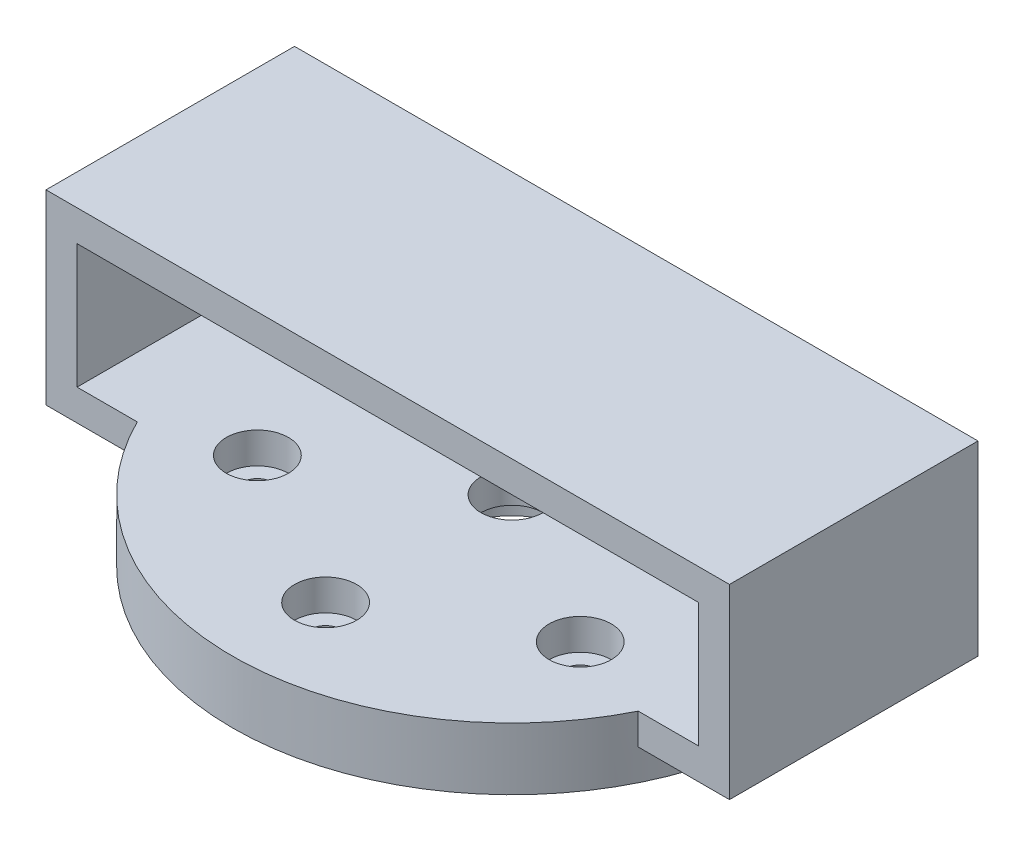
from build123d import *

# Parameters (mm, degrees)
SKETCH1_R                = 45
SKETCH1_R_2              = 2.5
SKETCH1_R_3              = 10
BOSS_EXTRUDE1_DEPTH      = 10
BOSS_EXTRUDE2_DEPTH      = 25
BOSS_EXTRUDE2_DEPTH_BACK = 5
SKETCH2_W                = 110
SKETCH2_H                = 40
SKETCH3_W                = 100
SKETCH3_H                = 20
CUT_EXTRUDE1_DEPTH       = 45
SKETCH4_R                = 5
CUT_EXTRUDE2_DEPTH       = 5


with BuildPart() as part:
    # Sketch1 → Boss-Extrude1 (new body)
    with BuildSketch(Plane(origin=(0, 0, 0), x_dir=(1, 0, 0), z_dir=(0, 1, 0))):
        with Locations(Location((0, 0, 0), (0, 0, 270))):
            Circle(SKETCH1_R)
        with Locations(Location((0, 30, 0), (0, 0, 270))):
            Circle(SKETCH1_R_2, mode=Mode.SUBTRACT)
        with Locations(Location((25.980762114, 15, 0), (0, 0, 270))):
            Circle(SKETCH1_R_2, mode=Mode.SUBTRACT)
        with Locations(Location((25.980762114, -15, 0), (0, 0, 270))):
            Circle(SKETCH1_R_2, mode=Mode.SUBTRACT)
        with Locations(Location((0, -30, 0), (0, 0, 270))):
            Circle(SKETCH1_R_2, mode=Mode.SUBTRACT)
        with Locations(Location((-25.980762114, -15, 0), (0, 0, 270))):
            Circle(SKETCH1_R_2, mode=Mode.SUBTRACT)
        with Locations(Location((-25.980762114, 15, 0), (0, 0, 270))):
            Circle(SKETCH1_R_2, mode=Mode.SUBTRACT)
        with Locations(Location((0, 0, 0), (0, 0, 270))):
            Circle(SKETCH1_R_3, mode=Mode.SUBTRACT)
    extrude(amount=BOSS_EXTRUDE1_DEPTH)

    # Sketch2 → Boss-Extrude2 (add, two sides: drawn at the far end of the back side and taken through both)
    with BuildSketch(Plane(origin=(0, 10, 0), x_dir=(1, 0, 0), z_dir=(0, 1, 0)).offset(-BOSS_EXTRUDE2_DEPTH_BACK)):
        Rectangle(SKETCH2_W, SKETCH2_H)
    extrude(amount=BOSS_EXTRUDE2_DEPTH + BOSS_EXTRUDE2_DEPTH_BACK)

    # Sketch3 → Cut-Extrude1 (cut)
    with BuildSketch(Plane(origin=(0, 0, -20), x_dir=(-1, 0, 0), z_dir=(0, 0, -1))):
        with Locations((0, 20)):
            Rectangle(SKETCH3_W, SKETCH3_H)
    extrude(amount=-CUT_EXTRUDE1_DEPTH, mode=Mode.SUBTRACT)

    # Sketch4 → Cut-Extrude2 (cut)
    with BuildSketch(Plane(origin=(0, 10, 0), x_dir=(1, 0, 0), z_dir=(0, 1, 0))):
        with Locations(Location((0, 30, 0), (0, 0, 270))):
            Circle(SKETCH4_R)
        with Locations(Location((25.980762114, 15, 0), (0, 0, 270))):
            Circle(SKETCH4_R)
        with Locations(Location((25.980762114, -15, 0), (0, 0, 270))):
            Circle(SKETCH4_R)
        with Locations(Location((0, -30, 0), (0, 0, 270))):
            Circle(SKETCH4_R)
        with Locations(Location((-25.980762114, -15, 0), (0, 0, 270))):
            Circle(SKETCH4_R)
        with Locations(Location((-25.980762114, 15, 0), (0, 0, 270))):
            Circle(SKETCH4_R)
        with Locations(Location((0, 0, 0), (0, 0, 270))):
            Circle(SKETCH4_R)
    extrude(amount=-CUT_EXTRUDE2_DEPTH, mode=Mode.SUBTRACT)


solid = part.part
